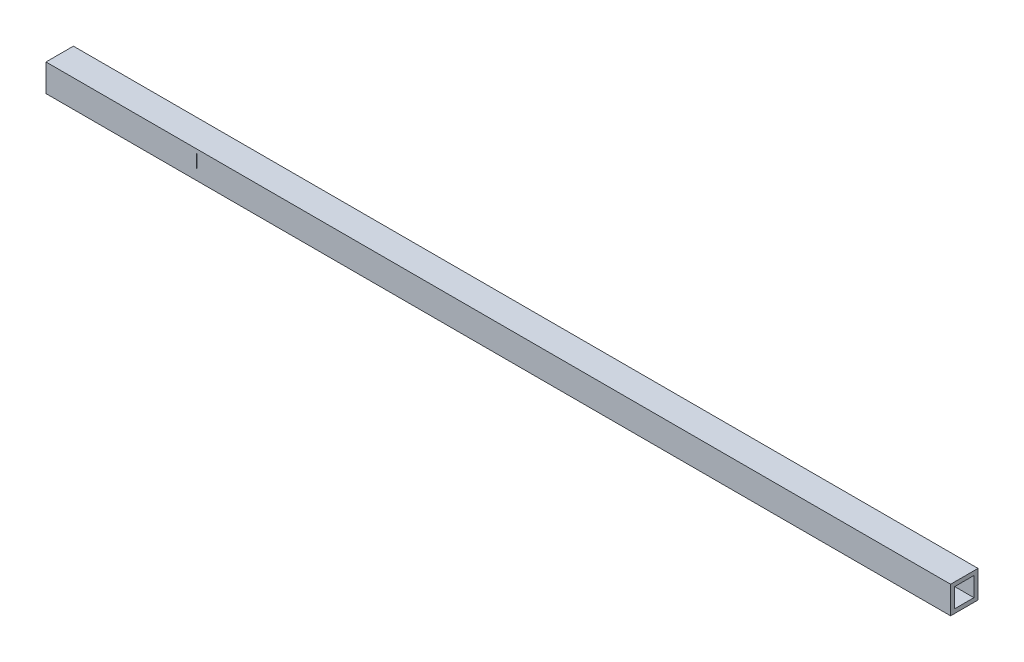
from build123d import *

# Parameters (mm, degrees)
CROQUIS1_W              = 330
CROQUIS1_H              = 10
SALIENTE_EXTRUIR1_DEPTH = 10
CROQUIS2_W              = 7
CROQUIS2_H              = 7
CORTAR_EXTRUIR1_DEPTH   = 331.075748882
CROQUIS3_W              = 0.02
CROQUIS3_H              = 4.666666667
CORTAR_EXTRUIR2_DEPTH   = 0.02
CROQUIS4_W              = 0.02
CROQUIS4_H              = 4.666666667
CORTAR_EXTRUIR3_DEPTH   = 0.02
CROQUIS5_W              = 0.02
CROQUIS5_H              = 4.666666667
CORTAR_EXTRUIR4_DEPTH   = 0.02
CROQUIS6_W              = 0.02
CROQUIS6_H              = 4.666666667
CORTAR_EXTRUIR5_DEPTH   = 0.02
CROQUIS7_W              = 0.02
CROQUIS7_H              = 4.666666667
CORTAR_EXTRUIR6_DEPTH   = 0.02
CROQUIS8_W              = 0.02
CROQUIS8_H              = 4.666666667
CORTAR_EXTRUIR7_DEPTH   = 0.02
CROQUIS9_W              = 0.02
CROQUIS9_H              = 4.666666667
CORTAR_EXTRUIR8_DEPTH   = 0.02
CROQUIS10_W             = 0.02
CROQUIS10_H             = 4.666666667
CORTAR_EXTRUIR9_DEPTH   = 0.02


with BuildPart() as part:
    # Croquis1 → Saliente-Extruir1 (new body)
    with BuildSketch(Plane.XZ.offset(5)):
        with Locations((165, 0)):
            Rectangle(CROQUIS1_W, CROQUIS1_H)
    extrude(amount=-SALIENTE_EXTRUIR1_DEPTH)

    # Croquis2 → Cortar-Extruir1 (cut, through all)
    with BuildSketch(Plane.ZY):
        Rectangle(CROQUIS2_W, CROQUIS2_H)
    extrude(amount=-CORTAR_EXTRUIR1_DEPTH, mode=Mode.SUBTRACT)

    # Croquis3 → Cortar-Extruir2 (cut)
    with BuildSketch(Plane.XY.offset(5)):
        with Locations((25, 1.166666666)):
            Rectangle(CROQUIS3_W, CROQUIS3_H)
    extrude(amount=-CORTAR_EXTRUIR2_DEPTH, mode=Mode.SUBTRACT)

    # Croquis4 → Cortar-Extruir3 (cut)
    with BuildSketch(Plane.XY.offset(5)):
        with Locations((35, 1.166666666)):
            Rectangle(CROQUIS4_W, CROQUIS4_H)
    extrude(amount=-CORTAR_EXTRUIR3_DEPTH, mode=Mode.SUBTRACT)

    # Croquis5 → Cortar-Extruir4 (cut)
    with BuildSketch(Plane.XY.offset(5)):
        with Locations((45, 1.166666666)):
            Rectangle(CROQUIS5_W, CROQUIS5_H)
    extrude(amount=-CORTAR_EXTRUIR4_DEPTH, mode=Mode.SUBTRACT)

    # Croquis6 → Cortar-Extruir5 (cut)
    with BuildSketch(Plane.XY.offset(5)):
        with Locations((55, 1.166666666)):
            Rectangle(CROQUIS6_W, CROQUIS6_H)
    extrude(amount=-CORTAR_EXTRUIR5_DEPTH, mode=Mode.SUBTRACT)

    # Croquis7 → Cortar-Extruir6 (cut)
    with BuildSketch(Plane.XY.offset(5)):
        with Locations((65, 1.166666666)):
            Rectangle(CROQUIS7_W, CROQUIS7_H)
    extrude(amount=-CORTAR_EXTRUIR6_DEPTH, mode=Mode.SUBTRACT)

    # Croquis8 → Cortar-Extruir7 (cut)
    with BuildSketch(Plane.XY.offset(5)):
        with Locations((75, 1.166666666)):
            Rectangle(CROQUIS8_W, CROQUIS8_H)
    extrude(amount=-CORTAR_EXTRUIR7_DEPTH, mode=Mode.SUBTRACT)

    # Croquis9 → Cortar-Extruir8 (cut)
    with BuildSketch(Plane.XY.offset(5)):
        with Locations((85, 1.166666666)):
            Rectangle(CROQUIS9_W, CROQUIS9_H)
    extrude(amount=-CORTAR_EXTRUIR8_DEPTH, mode=Mode.SUBTRACT)

    # Croquis10 → Cortar-Extruir9 (cut)
    with BuildSketch(Plane.XY.offset(5)):
        with Locations((15, 1.166666666)):
            Rectangle(CROQUIS10_W, CROQUIS10_H)
    extrude(amount=-CORTAR_EXTRUIR9_DEPTH, mode=Mode.SUBTRACT)


solid = part.part
